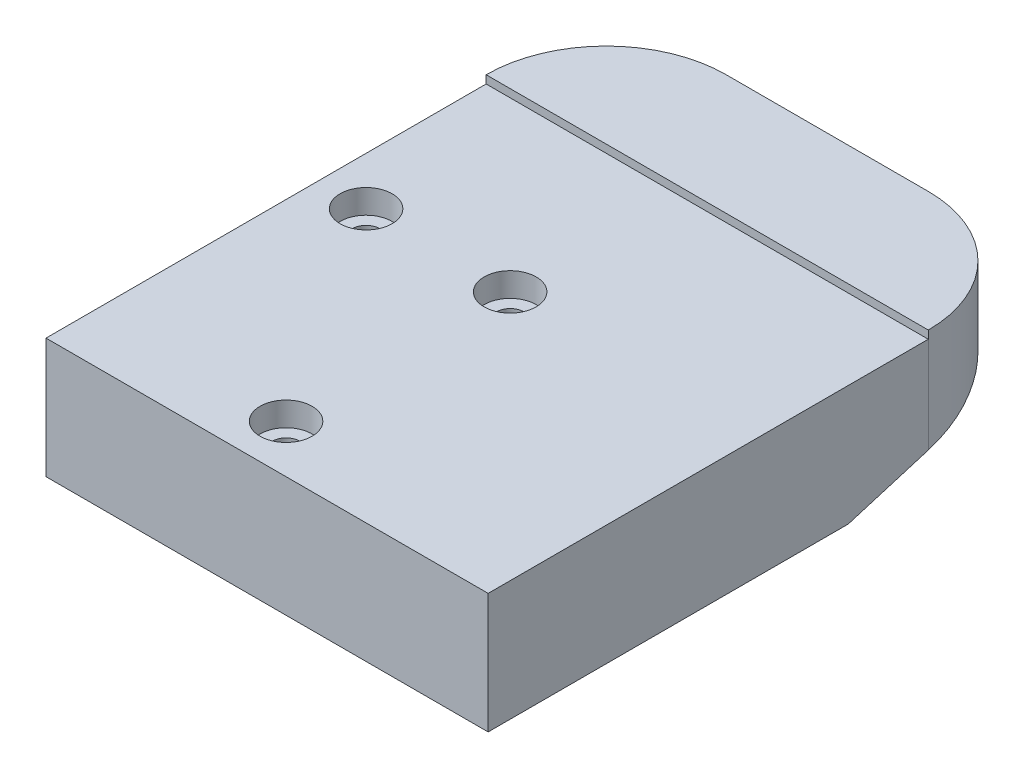
from build123d import *

# Parameters (mm, degrees)
BOSS_EXTRUDE1_DEPTH            = 15
CBORE_FOR_M3_SHCS1_D           = 3.4
CBORE_FOR_M3_SHCS1_CBORE_D     = 6.5
CBORE_FOR_M3_SHCS1_CBORE_DEPTH = 3
CUT_EXTRUDE1_REACH             = 92.43
BOSS_EXTRUDE2_DEPTH            = 1


with BuildPart() as part:
    # Sketch1 → Boss-Extrude1 (new body)
    with BuildSketch(Plane(origin=(0, 0, 0), x_dir=(1, 0, 0), z_dir=(0, 1, 0))):
        with BuildLine():
            Line((0, 0), (55.25, 0))
            Line((55.25, 0), (55.25, 55))
            ThreePointArc((55.25, 55), (50.856601718, 65.606601718), (40.25, 70))
            Line((40.25, 70), (15, 70))
            ThreePointArc((15, 70), (4.393398282, 65.606601718), (0, 55))
            Line((0, 55), (0, 0))
        make_face()
    extrude(amount=BOSS_EXTRUDE1_DEPTH)

    # CBORE for M3 SHCS1 (through all)
    with Locations(Plane(origin=(0, 15, 0), x_dir=(1, 0, 0), z_dir=(0, 1, 0))):
        with Locations((6, 34), (24, 34), (24, 6)):
            CounterBoreHole(CBORE_FOR_M3_SHCS1_D / 2, CBORE_FOR_M3_SHCS1_CBORE_D / 2, CBORE_FOR_M3_SHCS1_CBORE_DEPTH)

    # Sketch4 → Cut-Extrude1 (cut, up to next)
    with BuildSketch(Plane.ZY, mode=Mode.PRIVATE) as cut_extrude1_sk1:
        Polygon((-70, 0), (-45, 0), (-70, 7.5), align=None)
    cut_extrude1_tool1 = extrude(cut_extrude1_sk1.sketch, amount=-CUT_EXTRUDE1_REACH, mode=Mode.PRIVATE) & part.part
    add(cut_extrude1_tool1.solids().sort_by_distance((0, 2.5, -61.666667))[0], mode=Mode.SUBTRACT)

    # Sketch5 → Boss-Extrude2 (add)
    with BuildSketch(Plane(origin=(0, 15, 0), x_dir=(1, 0, 0), z_dir=(0, 1, 0))):
        with BuildLine():
            ThreePointArc((15, 70), (4.393398282, 65.606601718), (0, 55))
            Line((0, 55), (55.25, 55))
            ThreePointArc((55.25, 55), (50.856601718, 65.606601718), (40.25, 70))
            Line((40.25, 70), (15, 70))
        make_face()
    extrude(amount=BOSS_EXTRUDE2_DEPTH)


solid = part.part
